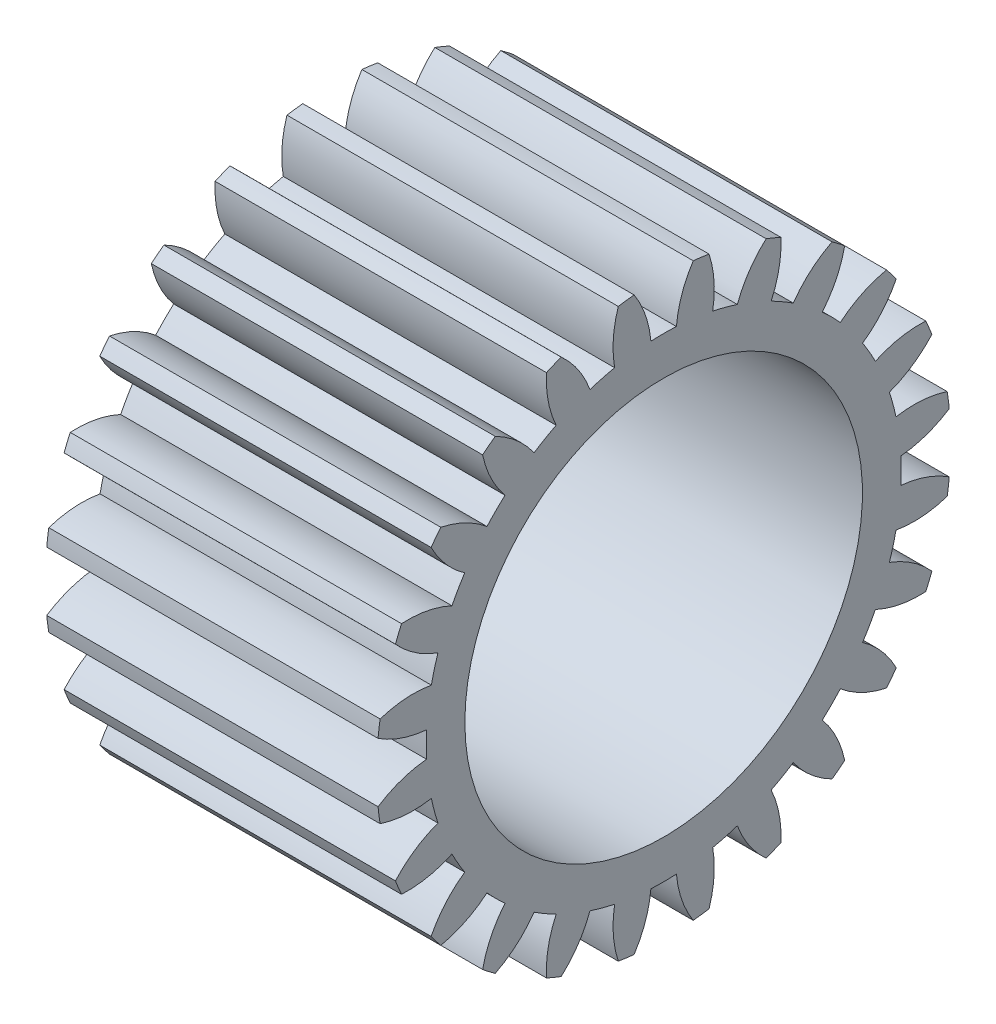
from build123d import *

# Parameters (mm, degrees)
BASPROSKE_W     = 31.75
BASPROSKE_H     = 27.516666667
TOOTHCUT_DEPTH  = 51.223464525
TEETHCUTS_COUNT = 24
TEETHCUTS_ANGLE = 345
BORSKE_R        = 19.05
BORE_DEPTH      = 50.8000508


with BuildPart() as part:
    # BasProSke → Base-Revolve (revolve)
    with BuildSketch(Plane(origin=(0, 0, 0), x_dir=(1, 0, 0), z_dir=(0, 1, 0)), mode=Mode.PRIVATE) as base_revolve_sk:
        with Locations((15.875, 13.758333334)):
            Rectangle(BASPROSKE_W, BASPROSKE_H)
    revolve(base_revolve_sk.sketch.rotate(Axis((-10, 0, 0), (1, 0, 0)), 180), axis=Axis((-10, 0, 0), (1, 0, 0)))

    # TooCutSke → ToothCut (cut, through all)
    with BuildSketch(Plane(origin=(0, 0, 0), x_dir=(0, 0, -1), z_dir=(1, 0, 0))):
        with BuildLine():
            ThreePointArc((1.22260082, 22.720025395), (0, 22.752896667), (-1.22260082, 22.720025395))
            ThreePointArc((-1.22260082, 22.720025395), (-1.746855623, 25.157718026), (-2.849051004, 27.394312268))
            ThreePointArc((-2.849051004, 27.394312268), (0, 27.542066667), (2.849051004, 27.394312268))
            ThreePointArc((2.849051004, 27.394312268), (1.746855623, 25.157718026), (1.22260082, 22.720025395))
        make_face()
    toothcut = extrude(amount=TOOTHCUT_DEPTH, mode=Mode.SUBTRACT)

    # TeethCuts: ToothCut ×24 about axis
    teethcuts_axis = Axis((-10, 0, 0), (1, 0, 0))
    for i in range(1, TEETHCUTS_COUNT):
        add(toothcut.rotate(teethcuts_axis, i * TEETHCUTS_ANGLE / (TEETHCUTS_COUNT - 1)), mode=Mode.SUBTRACT)

    # BorSke → Bore (cut, symmetric)
    with BuildSketch(Plane(origin=(0, 0, 0), x_dir=(0, 0, -1), z_dir=(1, 0, 0))):
        with Locations(Location((0, 0, 0), (0, 0, 180))):
            Circle(BORSKE_R)
    extrude(amount=BORE_DEPTH, both=True, mode=Mode.SUBTRACT)


solid = part.part
